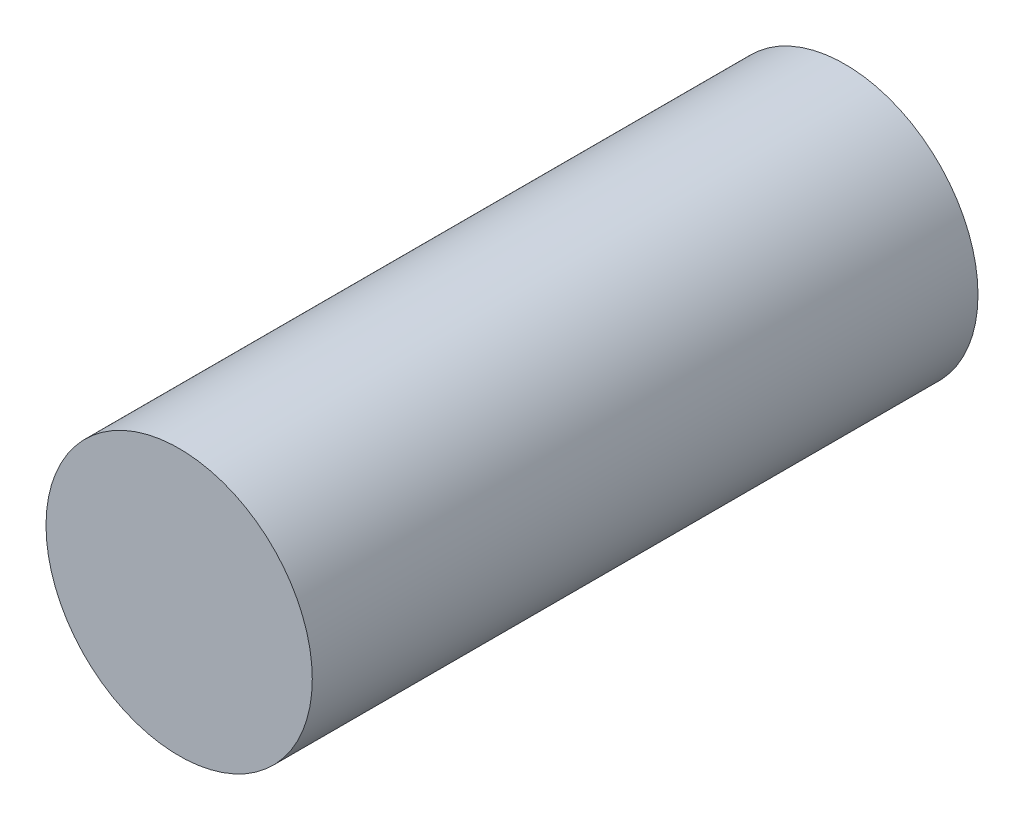
from build123d import *

# Parameters (mm, degrees)
SKETCH2_R           = 30
BOSS_EXTRUDE1_DEPTH = 150


with BuildPart() as part:
    # Sketch2 → Boss-Extrude1 (new body)
    with BuildSketch(Plane.XY):
        with Locations((-53.001198703, 15.900359611)):
            Circle(SKETCH2_R)
    extrude(amount=BOSS_EXTRUDE1_DEPTH)


solid = part.part
